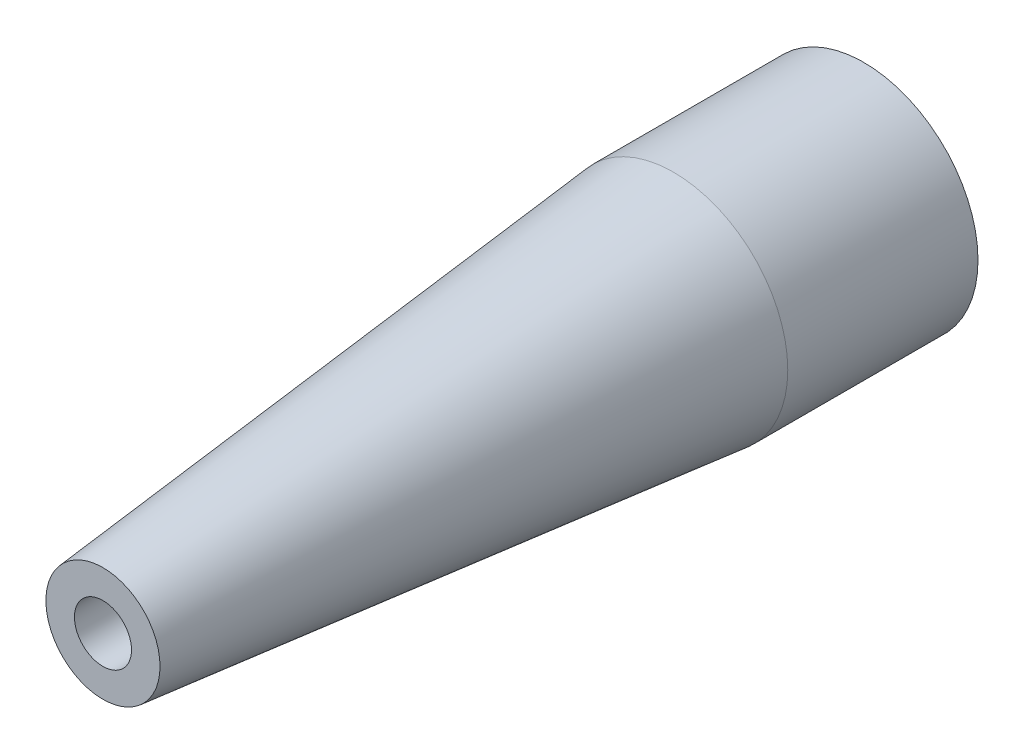
from build123d import *

# Parameters (mm, degrees)
ESQUISSE1_R        = 3
ESQUISSE1_R_2      = 0.75
BOSS_EXTRU_1_DEPTH = 20
CHANFREIN1_SIZE    = 15
CHANFREIN1_SIZE2   = 1.5


with BuildPart() as part:
    # Esquisse1 → Boss.-Extru.1 (new body)
    with BuildSketch(Plane.XY):
        Circle(ESQUISSE1_R)
        Circle(ESQUISSE1_R_2, mode=Mode.SUBTRACT)
    extrude(amount=BOSS_EXTRU_1_DEPTH)

    # Chanfrein1
    chanfrein1_edges = [part.edges().sort_by_distance(p)[0] for p in [
        (-3, 0, 20),
    ]]
    chanfrein1_side = [part.faces().sort_by_distance(p)[0] for p in [
        (-3, 0, 10),
    ]]
    chamfer(chanfrein1_edges, length=CHANFREIN1_SIZE, length2=CHANFREIN1_SIZE2, reference=chanfrein1_side[0])


solid = part.part
